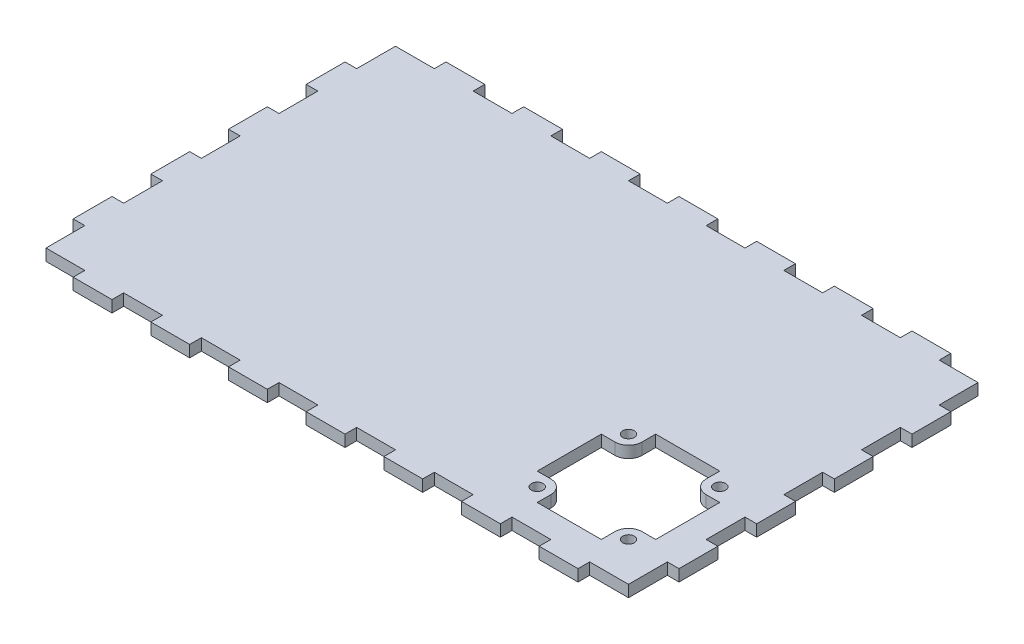
from build123d import *

# Parameters (mm, degrees)
BOSS_EXTRUDE1_DEPTH = 3
SKETCH3_R           = 1.5
CUT_EXTRUDE2_DEPTH  = 3
CUT_EXTRUDE3_DEPTH  = 3


with BuildPart() as part:
    # Sketch1 → Boss-Extrude1 (new body)
    with BuildSketch(Plane(origin=(0, 0, 0), x_dir=(1, 0, 0), z_dir=(0, 1, 0))):
        Polygon((-5, 48), (5, 48), (5, 45), (15, 45), (15, 48), (25, 48), (25, 45), (35, 45), (35, 48), (45, 48), (45, 45), (55, 45), (55, 48), (65, 48), (65, 45), (75, 45), (75, 35), (78, 35), (78, 25), (75, 25), (75, 15), (78, 15), (78, 5), (75, 5), (75, -5), (78, -5), (78, -15), (75, -15), (75, -25), (78, -25), (78, -35), (75, -35), (75, -45), (65, -45), (65, -48), (55, -48), (55, -45), (45, -45), (45, -48), (35, -48), (35, -45), (25, -45), (25, -48), (15, -48), (15, -45), (5, -45), (5, -48), (-5, -48), (-5, -45), (-15, -45), (-15, -48), (-25, -48), (-25, -45), (-35, -45), (-35, -48), (-45, -48), (-45, -45), (-55, -45), (-55, -48), (-65, -48), (-65, -45), (-75, -45), (-75, -35), (-78, -35), (-78, -25), (-75, -25), (-75, -15), (-78, -15), (-78, -5), (-75, -5), (-75, 5), (-78, 5), (-78, 15), (-75, 15), (-75, 25), (-78, 25), (-78, 35), (-75, 35), (-75, 45), (-65, 45), (-65, 48), (-55, 48), (-55, 45), (-45, 45), (-45, 48), (-35, 48), (-35, 45), (-25, 45), (-25, 48), (-15, 48), (-15, 45), (-5, 45), align=None)
    extrude(amount=BOSS_EXTRUDE1_DEPTH)

    # Sketch3 → Cut-Extrude2 (cut)
    with BuildSketch(Plane(origin=(0, 3, 0), x_dir=(1, 0, 0), z_dir=(0, 1, 0))):
        with Locations(Location((41.5, -11.5, 0), (0, 0, 270))):
            Circle(SKETCH3_R)
        with Locations(Location((65, -11.5, 0), (0, 0, 270))):
            Circle(SKETCH3_R)
        with Locations(Location((65, -35, 0), (0, 0, 270))):
            Circle(SKETCH3_R)
        with Locations(Location((41.5, -35, 0), (0, 0, 270))):
            Circle(SKETCH3_R)
    extrude(amount=-CUT_EXTRUDE2_DEPTH, mode=Mode.SUBTRACT)

    # Sketch4 → Cut-Extrude3 (cut)
    with BuildSketch(Plane(origin=(0, 3, 0), x_dir=(1, 0, 0), z_dir=(0, 1, 0))):
        with BuildLine():
            Line((45, -35), (45, -38.5))
            Line((45, -38.5), (61.5, -38.5))
            Line((61.5, -38.5), (61.5, -35))
            ThreePointArc((61.5, -35), (62.525126266, -32.525126266), (65, -31.5))
            Line((65, -31.5), (68.5, -31.5))
            Line((68.5, -31.5), (68.5, -15))
            Line((68.5, -15), (65, -15))
            ThreePointArc((65, -15), (62.525126266, -13.974873734), (61.5, -11.5))
            Line((61.5, -11.5), (61.5, -8))
            Line((61.5, -8), (45, -8))
            Line((45, -8), (45, -11.5))
            ThreePointArc((45, -11.5), (43.974873734, -13.974873734), (41.5, -15))
            Line((41.5, -15), (38, -15))
            Line((38, -15), (38, -31.5))
            Line((38, -31.5), (41.5, -31.5))
            ThreePointArc((41.5, -31.5), (43.974873734, -32.525126266), (45, -35))
        make_face()
    extrude(amount=-CUT_EXTRUDE3_DEPTH, mode=Mode.SUBTRACT)


solid = part.part
